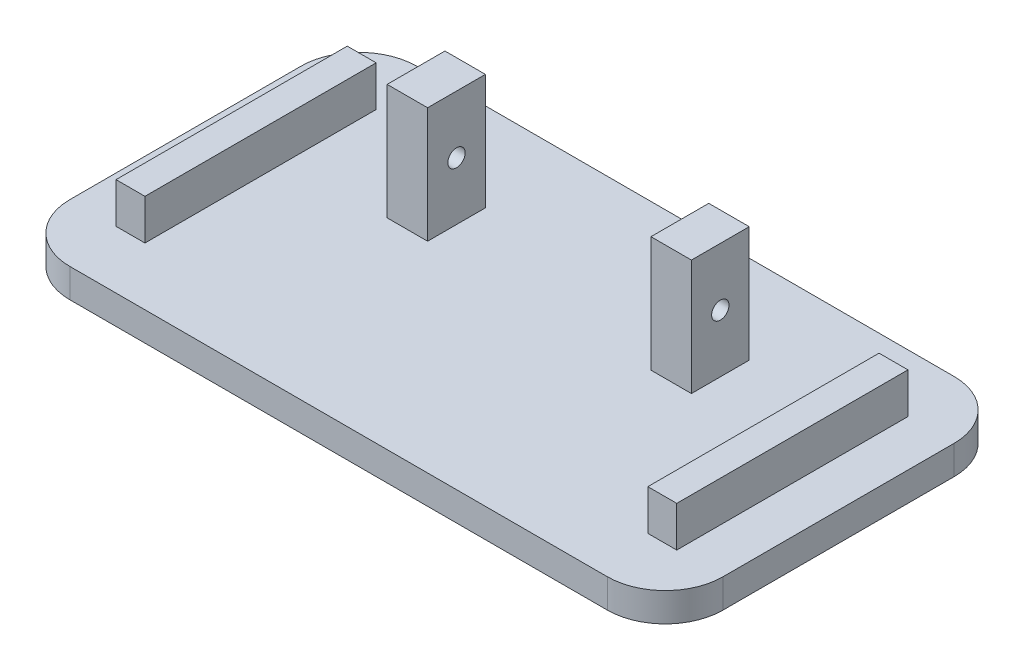
from build123d import *

# Parameters (mm, degrees)
RESSALTO_EXTRUS_O1_DEPTH = 5
ESBO_O2_W                = 7
ESBO_O2_H                = 10
RESSALTO_EXTRUS_O2_DEPTH = 20
ESBO_O4_R                = 1.5
CORTE_EXTRUS_O1_DEPTH    = 98.269963506
ESBO_O5_W                = 5
ESBO_O5_H                = 40
RESSALTO_EXTRUS_O3_DEPTH = 7


with BuildPart() as part:
    # Esboço1 → Ressalto-extrusão1 (new body)
    with BuildSketch(Plane(origin=(0, 0, 0), x_dir=(1, 0, 0), z_dir=(0, 1, 0))):
        with BuildLine():
            Line((-13.214501511, 15.533232628), (79.785498489, 15.533232628))
            ThreePointArc((79.785498489, 15.533232628), (86.856566301, 12.60430044), (89.785498489, 5.533232628))
            Line((89.785498489, 5.533232628), (89.785498489, -34.466767372))
            ThreePointArc((89.785498489, -34.466767372), (86.856566301, -41.537835183), (79.785498489, -44.466767372))
            Line((79.785498489, -44.466767372), (-13.214501511, -44.466767372))
            ThreePointArc((-13.214501511, -44.466767372), (-20.285569322, -41.537835183), (-23.214501511, -34.466767372))
            Line((-23.214501511, -34.466767372), (-23.214501511, 5.533232628))
            ThreePointArc((-23.214501511, 5.533232628), (-20.285569322, 12.60430044), (-13.214501511, 15.533232628))
        make_face()
    extrude(amount=RESSALTO_EXTRUS_O1_DEPTH)

    # Esboço2 → Ressalto-extrusão2 (add)
    with BuildSketch(Plane(origin=(0, 5, 0), x_dir=(1, 0, 0), z_dir=(0, 1, 0))):
        with Locations((56.105498489, -4.747557162)):
            Rectangle(ESBO_O2_W, ESBO_O2_H)
        with Locations((10.465498489, -4.747557162)):
            Rectangle(ESBO_O2_W, ESBO_O2_H)
    extrude(amount=RESSALTO_EXTRUS_O2_DEPTH)

    # Esboço4 → Corte-extrusão1 (cut, through all)
    with BuildSketch(Plane.ZY.offset(-6.965498489)):
        with Locations((4.747557162, 15)):
            Circle(ESBO_O4_R)
    extrude(amount=-CORTE_EXTRUS_O1_DEPTH, mode=Mode.SUBTRACT)

    # Esboço5 → Ressalto-extrusão3 (add)
    with BuildSketch(Plane(origin=(0, 5, 0), x_dir=(1, 0, 0), z_dir=(0, 1, 0))):
        with Locations((-12.714501511, -14.466767372)):
            Rectangle(ESBO_O5_W, ESBO_O5_H)
        with Locations((79.285498489, -14.466767372)):
            Rectangle(ESBO_O5_W, ESBO_O5_H)
    extrude(amount=RESSALTO_EXTRUS_O3_DEPTH)


solid = part.part
